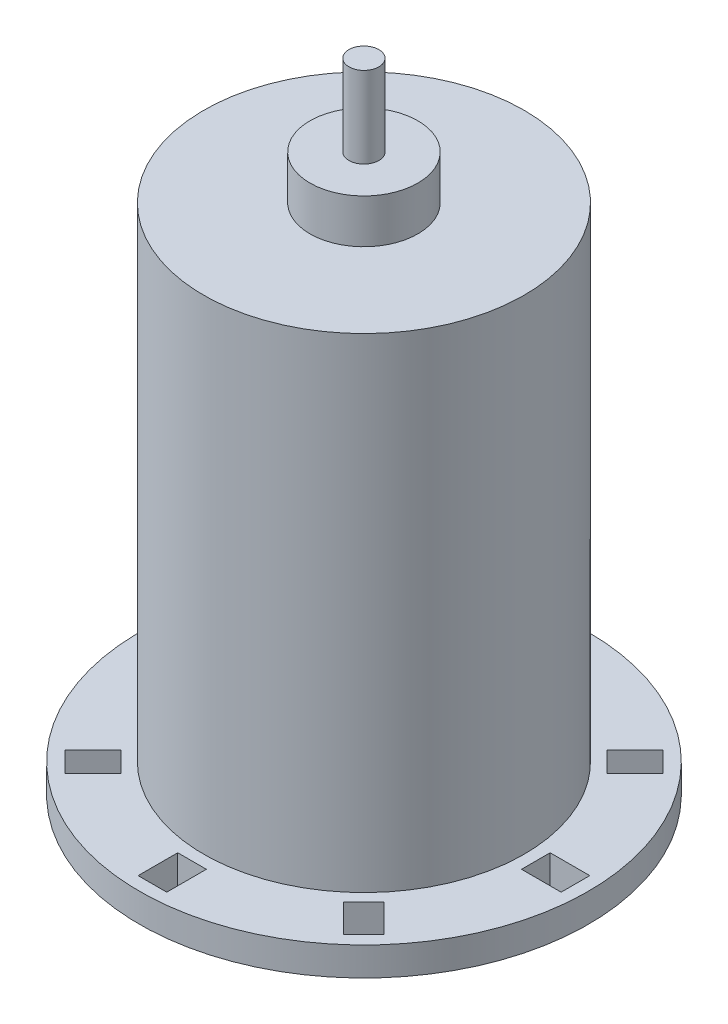
from build123d import *

# Parameters (mm, degrees)
SKICA1_R                 = 16.78
P_IDAT_VYSUNUT_M1_DEPTH  = 50.7
SKICA2_R                 = 5.65
P_IDAT_VYSUNUT_M2_DEPTH  = 4.61
SKICA3_R                 = 1.565
P_IDAT_VYSUNUT_M3_DEPTH  = 8.5
SKETCH6_R                = 23.5
BOSS_EXTRUDE1_DEPTH      = 3
SKETCH8_W                = 4.15
SKETCH8_H                = 3
SKETCH8_W_2              = 3
SKETCH8_H_2              = 4.15
ODEBRAT_VYSUNUT_M2_DEPTH = 3


with BuildPart() as part:
    # Skica1 → Přidat vysunutím1 (new body)
    with BuildSketch(Plane(origin=(0, 0, 0), x_dir=(1, 0, 0), z_dir=(0, 1, 0))):
        with Locations(Location((0, 0, 0), (0, 0, 90))):
            Circle(SKICA1_R)
    extrude(amount=P_IDAT_VYSUNUT_M1_DEPTH)

    # Skica2 → Přidat vysunutím2 (add)
    with BuildSketch(Plane(origin=(0, 50.7, 0), x_dir=(1, 0, 0), z_dir=(0, 1, 0))):
        with Locations(Location((0, 0, 0), (0, 0, 270))):
            Circle(SKICA2_R)
    extrude(amount=P_IDAT_VYSUNUT_M2_DEPTH)

    # Skica3 → Přidat vysunutím3 (add)
    with BuildSketch(Plane(origin=(0, 55.31, 0), x_dir=(1, 0, 0), z_dir=(0, 1, 0))):
        with Locations(Location((0, 0, 0), (0, 0, 270))):
            Circle(SKICA3_R)
    extrude(amount=P_IDAT_VYSUNUT_M3_DEPTH)

    # Sketch6 → Boss-Extrude1 (add)
    with BuildSketch(Plane.XZ):
        with Locations(Location((0, 0, 0), (0, 0, 270))):
            Circle(SKETCH6_R)
    extrude(amount=BOSS_EXTRUDE1_DEPTH)

    # Sketch8 → Odebrat vysunutím2 (cut)
    with BuildSketch(Plane(origin=(0, 0, 0), x_dir=(1, 0, 0), z_dir=(0, 1, 0))):
        with Locations((20.075, 0)):
            Rectangle(SKETCH8_W, SKETCH8_H)
        Polygon((11.66726189, -13.788582233), (14.601755032, -16.723075375), (16.723075375, -14.601755032), (13.788582233, -11.66726189), align=None)
        with Locations((0, -20.075)):
            Rectangle(SKETCH8_W_2, SKETCH8_H_2)
        Polygon((-13.788582233, -11.66726189), (-16.723075375, -14.601755032), (-14.601755032, -16.723075375), (-11.66726189, -13.788582233), align=None)
        with Locations((-20.075, 0)):
            Rectangle(SKETCH8_W, SKETCH8_H)
        Polygon((-11.66726189, 13.788582233), (-14.601755032, 16.723075375), (-16.723075375, 14.601755032), (-13.788582233, 11.66726189), align=None)
        with Locations((0, 20.075)):
            Rectangle(SKETCH8_W_2, SKETCH8_H_2)
        Polygon((13.788582233, 11.66726189), (16.723075375, 14.601755032), (14.601755032, 16.723075375), (11.66726189, 13.788582233), align=None)
        Polygon((6.151828996, -8.27314934), (9.086322138, -11.207642482), (11.207642482, -9.086322138), (8.27314934, -6.151828996), align=None)
        Polygon((-8.27314934, -6.151828996), (-11.207642482, -9.086322138), (-9.086322138, -11.207642482), (-6.151828996, -8.27314934), align=None)
        Polygon((-6.151828996, 8.27314934), (-9.086322138, 11.207642482), (-11.207642482, 9.086322138), (-8.27314934, 6.151828996), align=None)
        Polygon((8.27314934, 6.151828996), (11.207642482, 9.086322138), (9.086322138, 11.207642482), (6.151828996, 8.27314934), align=None)
    extrude(amount=-ODEBRAT_VYSUNUT_M2_DEPTH, mode=Mode.SUBTRACT)


solid = part.part
